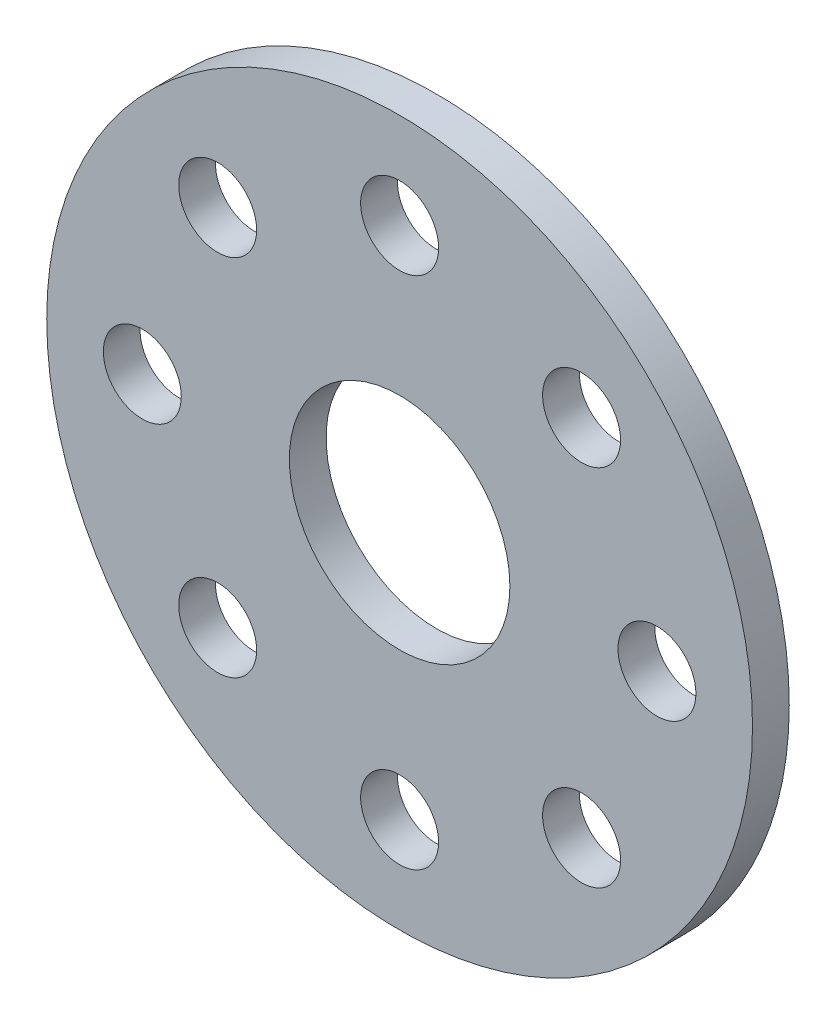
from build123d import *

# Parameters (mm, degrees)
SKETCH1_R            = 24
SKETCH1_R_2          = 7.5
BOSS_EXTRUDE1_DEPTH  = 1.25
M5_CLEARANCE_HOLE1_D = 5.3


with BuildPart() as part:
    # Sketch1 → Boss-Extrude1 (new, symmetric)
    with BuildSketch(Plane.XY):
        Circle(SKETCH1_R)
        Circle(SKETCH1_R_2, mode=Mode.SUBTRACT)
    extrude(amount=BOSS_EXTRUDE1_DEPTH, both=True)

    # M5 Clearance Hole1 (through all)
    with Locations(Plane.XY.offset(1.25)):
        with Locations((0, -17.5), (-12.374368671, -12.374368671), (-17.5, 0), (-12.374368671, 12.374368671), (0, 17.5), (12.374368671, 12.374368671), (17.5, 0), (12.374368671, -12.374368671)):
            Hole(M5_CLEARANCE_HOLE1_D / 2)


solid = part.part
